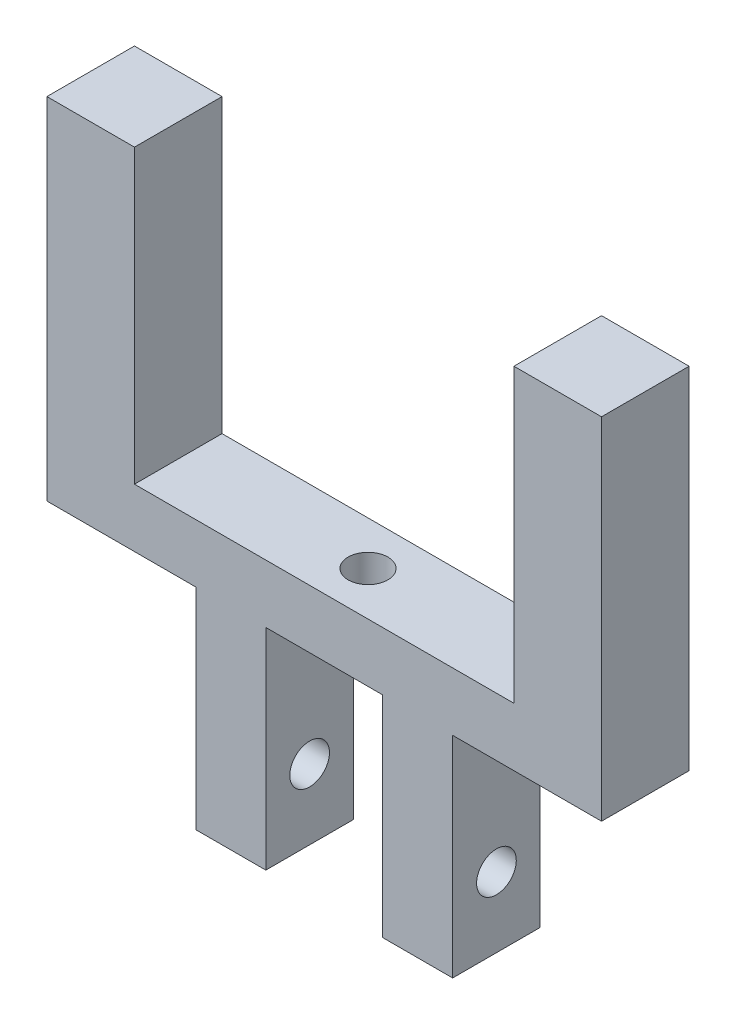
from build123d import *

# Parameters (mm, degrees)
RESSALTO_EXTRUS_O1_DEPTH = 7.5
ESBO_O2_R                = 1.7
CORTE_EXTRUS_O1_DEPTH    = 60.731168581
ESBO_O3_R                = 1.7
CORTE_EXTRUS_O2_DEPTH    = 55.076912819


with BuildPart() as part:
    # Esboço1 → Ressalto-extrusão1 (new body)
    with BuildSketch(Plane.XY):
        Polygon((-23.75, 0), (-23.75, -30), (-11, -30), (-11, -48), (-5, -48), (-5, -40), (-5, -30), (0, -30), (0, -25), (-16.25, -25), (-16.25, 0), align=None)
    ressalto_extrus_o1 = extrude(amount=RESSALTO_EXTRUS_O1_DEPTH)

    # Espelhar1: Ressalto-extrusão1 across plane
    add(ressalto_extrus_o1.mirror(Plane(origin=(0, -30, 7.5), x_dir=(0, 0, 1), z_dir=(-1, 0, 0))))

    # Esboço2 → Corte-extrusão1 (cut, through all)
    with BuildSketch(Plane(origin=(11, 0, 0), x_dir=(0, 0, -1), z_dir=(1, 0, 0))):
        with Locations(Location((-3.75, -42, 0), (0, 0, 90))):
            Circle(ESBO_O2_R)
    extrude(amount=-CORTE_EXTRUS_O1_DEPTH, mode=Mode.SUBTRACT)

    # Esboço3 → Corte-extrusão2 (cut, through all)
    with BuildSketch(Plane(origin=(0, 0, 0), x_dir=(1, 0, 0), z_dir=(0, 1, 0))):
        with Locations(Location((0, -3.75, 0), (0, 0, 180))):
            Circle(ESBO_O3_R)
    extrude(amount=-CORTE_EXTRUS_O2_DEPTH, mode=Mode.SUBTRACT)


solid = part.part
